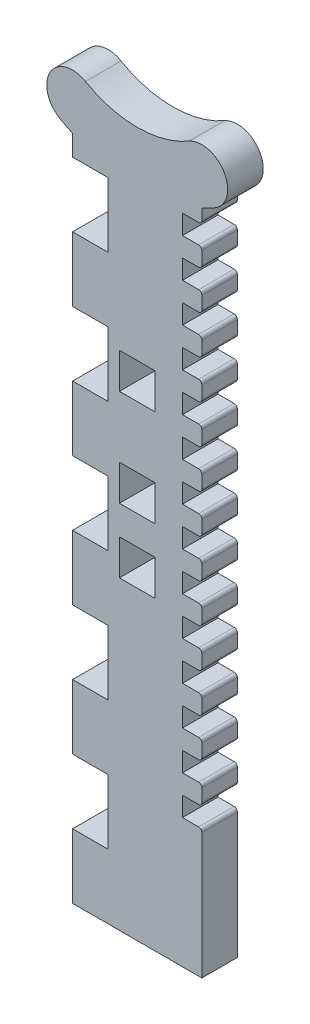
from build123d import *

# Parameters (mm, degrees)
EXTRUDE_1_DEPTH     = 5.5
SKETCH_2_W          = 5.5
SKETCH_2_H          = 10
SKETCH_2_W_2        = 3
SKETCH_2_H_2        = 3
CUT_EXTRUDE_1_DEPTH = 126.901747406
SKETCH_5_W          = 5.5
SKETCH_5_H          = 5.5
CUT_EXTRUDE_2_DEPTH = 126.901747406
FILLET_1_R          = 0.5


with BuildPart() as part:
    # ｽｹｯﾁ1 → ﾎﾞｽ - 押し出し1 (new body)
    with BuildSketch(Plane.XY):
        with BuildLine():
            Line((-10, -21.817424229), (-10, -125))
            Line((-10, -125), (10, -125))
            Line((10, -125), (10, -21.817424229))
            ThreePointArc((10, -21.817424229), (11.012114986, -21.324477099), (12, -20.784609691))
            ThreePointArc((12, -20.784609691), (13.464101615, -15.320508076), (8, -13.856406461))
            ThreePointArc((8, -13.856406461), (0, -16), (-8, -13.856406461))
            ThreePointArc((-8, -13.856406461), (-13.464101615, -15.320508076), (-12, -20.784609691))
            ThreePointArc((-12, -20.784609691), (-11.012114986, -21.324477099), (-10, -21.817424229))
        make_face()
    extrude(amount=EXTRUDE_1_DEPTH)

    # ｽｹｯﾁ2 → ｶｯﾄ - 押し出し1 (cut, through all)
    with BuildSketch(Plane.XY.offset(5.5)):
        with Locations((-7.25, -90)):
            Rectangle(SKETCH_2_W, SKETCH_2_H)
        with Locations((-7.25, -110)):
            Rectangle(SKETCH_2_W, SKETCH_2_H)
        with Locations((-7.25, -70)):
            Rectangle(SKETCH_2_W, SKETCH_2_H)
        with Locations((-7.25, -50)):
            Rectangle(SKETCH_2_W, SKETCH_2_H)
        with Locations((-7.25, -30)):
            Rectangle(SKETCH_2_W, SKETCH_2_H)
        with Locations((8.5, -103.5)):
            Rectangle(SKETCH_2_W_2, SKETCH_2_H_2)
        with Locations((8.5, -97.5)):
            Rectangle(SKETCH_2_W_2, SKETCH_2_H_2)
        with Locations((8.5, -91.5)):
            Rectangle(SKETCH_2_W_2, SKETCH_2_H_2)
        with Locations((8.5, -85.5)):
            Rectangle(SKETCH_2_W_2, SKETCH_2_H_2)
        with Locations((8.5, -79.5)):
            Rectangle(SKETCH_2_W_2, SKETCH_2_H_2)
        with Locations((8.5, -73.5)):
            Rectangle(SKETCH_2_W_2, SKETCH_2_H_2)
        with Locations((8.5, -67.5)):
            Rectangle(SKETCH_2_W_2, SKETCH_2_H_2)
        with Locations((8.5, -61.5)):
            Rectangle(SKETCH_2_W_2, SKETCH_2_H_2)
        with Locations((8.5, -55.5)):
            Rectangle(SKETCH_2_W_2, SKETCH_2_H_2)
        with Locations((8.5, -49.5)):
            Rectangle(SKETCH_2_W_2, SKETCH_2_H_2)
        with Locations((8.5, -43.5)):
            Rectangle(SKETCH_2_W_2, SKETCH_2_H_2)
        with Locations((8.5, -37.5)):
            Rectangle(SKETCH_2_W_2, SKETCH_2_H_2)
        with Locations((8.5, -31.5)):
            Rectangle(SKETCH_2_W_2, SKETCH_2_H_2)
        with Locations((8.5, -25.5)):
            Rectangle(SKETCH_2_W_2, SKETCH_2_H_2)
    extrude(amount=-CUT_EXTRUDE_1_DEPTH, mode=Mode.SUBTRACT)

    # ｽｹｯﾁ5 → ｶｯﾄ - 押し出し2 (cut, through all)
    with BuildSketch(Plane.XY.offset(5.5)):
        with Locations((0, -65)):
            Rectangle(SKETCH_5_W, SKETCH_5_H)
        with Locations((0, -50)):
            Rectangle(SKETCH_5_W, SKETCH_5_H)
        with Locations((0, -75)):
            Rectangle(SKETCH_5_W, SKETCH_5_H)
    extrude(amount=-CUT_EXTRUDE_2_DEPTH, mode=Mode.SUBTRACT)

    # ﾌｨﾚｯﾄ1
    fillet_1_edges = [part.edges().sort_by_distance(p)[0] for p in [
        (10, -39, 2.75),
        (10, -36, 2.75),
        (10, -45, 2.75),
        (10, -42, 2.75),
        (10, -51, 2.75),
        (10, -48, 2.75),
        (10, -57, 2.75),
        (10, -54, 2.75),
        (10, -63, 2.75),
        (10, -60, 2.75),
        (10, -69, 2.75),
        (10, -66, 2.75),
        (10, -75, 2.75),
        (10, -72, 2.75),
        (10, -81, 2.75),
        (10, -78, 2.75),
        (10, -87, 2.75),
        (10, -84, 2.75),
        (10, -93, 2.75),
        (10, -90, 2.75),
        (10, -99, 2.75),
        (10, -96, 2.75),
        (10, -102, 2.75),
        (10, -105, 2.75),
        (10, -33, 2.75),
        (10, -30, 2.75),
        (10, -27, 2.75),
        (10, -24, 2.75),
    ]]
    fillet(fillet_1_edges, radius=FILLET_1_R)


solid = part.part
